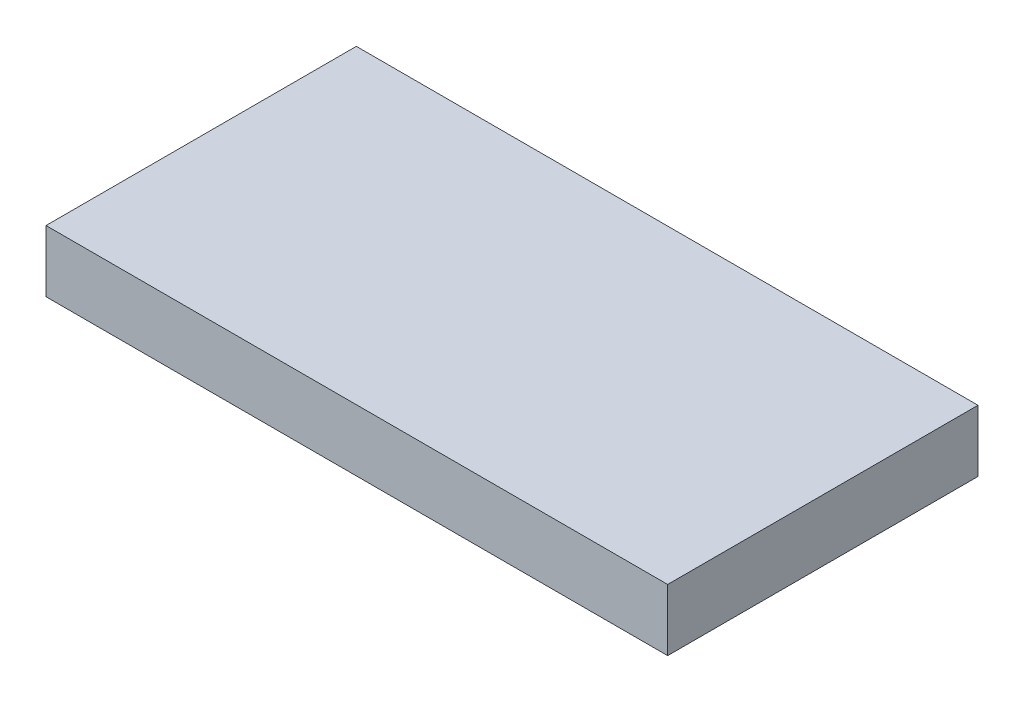
from build123d import *

# Parameters (mm, degrees)
SKETCH2_W           = 31.75
SKETCH2_H           = 15.85
BOSS_EXTRUDE1_DEPTH = 3.15
SHELL1_T            = -1.5
SKETCH3_R           = 3.225
SKETCH3_R_2         = 2.475
BOSS_EXTRUDE2_DEPTH = 1.45


with BuildPart() as part:
    # Sketch2 → Boss-Extrude1 (new body)
    with BuildSketch(Plane(origin=(0, 0, 0), x_dir=(1, 0, 0), z_dir=(0, 1, 0))):
        Rectangle(SKETCH2_W, SKETCH2_H)
    extrude(amount=-BOSS_EXTRUDE1_DEPTH)

    # Shell1
    shell1_openings = [part.faces().sort_by_distance(p)[0] for p in [
        (0, -3.15, 0),
    ]]
    offset(amount=SHELL1_T, openings=shell1_openings, kind=Kind.INTERSECTION)

    # Sketch3 → Boss-Extrude2 (add)
    # profile 1 of 3: a face of its own
    with BuildSketch(Plane.XZ.offset(1.5)):
        with Locations(Location((0, 0, 0), (0, 0, 90))):
            Circle(SKETCH3_R)
        with Locations(Location((0, 0, 0), (0, 0, 90))):
            Circle(SKETCH3_R_2, mode=Mode.SUBTRACT)
    # profile 2 of 3: a face of its own
    with BuildSketch(Plane.XZ.offset(1.5)):
        with Locations(Location((-7.9375, 0, 0), (0, 0, 90))):
            Circle(SKETCH3_R)
        with Locations(Location((-7.9375, 0, 0), (0, 0, 90))):
            Circle(SKETCH3_R_2, mode=Mode.SUBTRACT)
    # profile 3 of 3: a face of its own
    with BuildSketch(Plane.XZ.offset(1.5)):
        with Locations(Location((7.9375, 0, 0), (0, 0, 90))):
            Circle(SKETCH3_R)
        with Locations(Location((7.9375, 0, 0), (0, 0, 90))):
            Circle(SKETCH3_R_2, mode=Mode.SUBTRACT)
    extrude(amount=BOSS_EXTRUDE2_DEPTH)


solid = part.part
